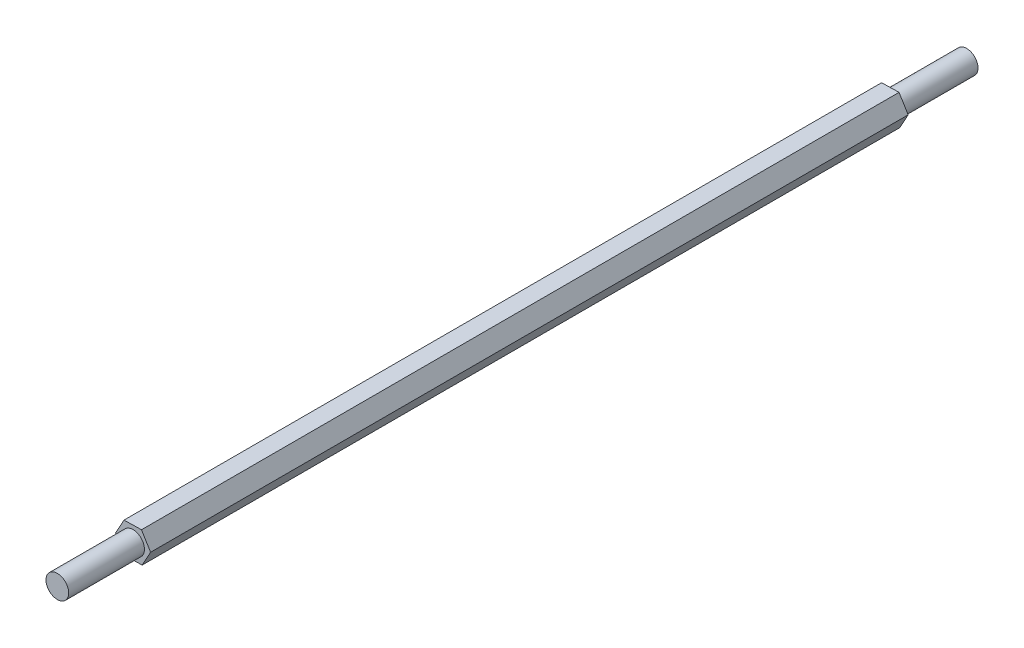
from build123d import *

# Parameters (mm, degrees)
BOSS_EXTRUDE1_DEPTH = 100
SKETCH3_R           = 1.5
BOSS_EXTRUDE2_DEPTH = 10
SKETCH4_R           = 1.5
BOSS_EXTRUDE3_DEPTH = 10


with BuildPart() as part:
    # Sketch2 → Boss-Extrude1 (new body)
    with BuildSketch(Plane.XY):
        Polygon((-18.575897145, 5.546778343), (-20.884739637, 5.495987805), (-21.995174987, 3.471076285), (-20.796767845, 1.496955302), (-18.487925352, 1.54774584), (-17.377490002, 3.57265736), align=None)
    extrude(amount=BOSS_EXTRUDE1_DEPTH)

    # Sketch3 → Boss-Extrude2 (add)
    with BuildSketch(Plane.XY.offset(100)):
        with Locations((-19.683896115, 3.505839662)):
            Circle(SKETCH3_R)
    extrude(amount=BOSS_EXTRUDE2_DEPTH)

    # Sketch4 → Boss-Extrude3 (add)
    with BuildSketch(Plane(origin=(0, 0, 0), x_dir=(-1, 0, 0), z_dir=(0, 0, -1))):
        with Locations((19.653785762, 3.532451742)):
            Circle(SKETCH4_R)
    extrude(amount=BOSS_EXTRUDE3_DEPTH)


solid = part.part
